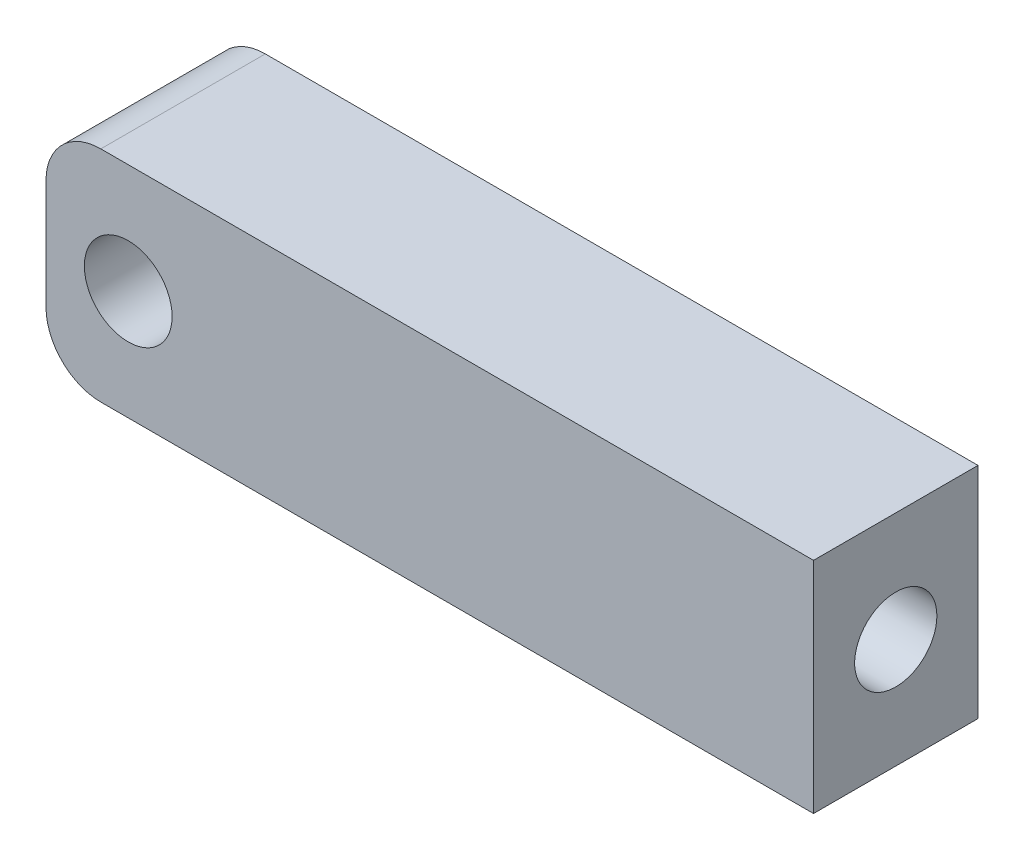
from build123d import *

# Parameters (mm, degrees)
SKETCH_2_R          = 1.6
EXTRUDE_1_DEPTH     = 6
SKETCH_3_R          = 1.5
CUT_EXTRUDE_1_DEPTH = 20
SKETCH_4_R          = 3.6
CUT_EXTRUDE_2_DEPTH = 3


with BuildPart() as part:
    # 草图2 → 凸台-拉伸1 (new body)
    with BuildSketch(Plane.XY):
        with BuildLine():
            Line((0, 2), (0, 6))
            ThreePointArc((0, 6), (0.585786438, 7.414213562), (2, 8))
            Line((2, 8), (28, 8))
            Line((28, 8), (28, 0))
            Line((28, 0), (2, 0))
            ThreePointArc((2, 0), (0.585786438, 0.585786438), (0, 2))
        make_face()
        with Locations((3, 4)):
            Circle(SKETCH_2_R, mode=Mode.SUBTRACT)
    extrude(amount=EXTRUDE_1_DEPTH)

    # 草图3 → 切除-拉伸1 (cut)
    with BuildSketch(Plane(origin=(28, 0, 0), x_dir=(0, 0, -1), z_dir=(1, 0, 0))):
        with Locations((-3, 4)):
            Circle(SKETCH_3_R)
    extrude(amount=-CUT_EXTRUDE_1_DEPTH, mode=Mode.SUBTRACT)

    # 草图4 → 切除-拉伸2 (cut)
    with BuildSketch(Plane(origin=(0, 0, 0), x_dir=(-1, 0, 0), z_dir=(0, 0, -1))):
        with Locations((-3, 4)):
            Circle(SKETCH_4_R)
    extrude(amount=-CUT_EXTRUDE_2_DEPTH, mode=Mode.SUBTRACT)


solid = part.part
